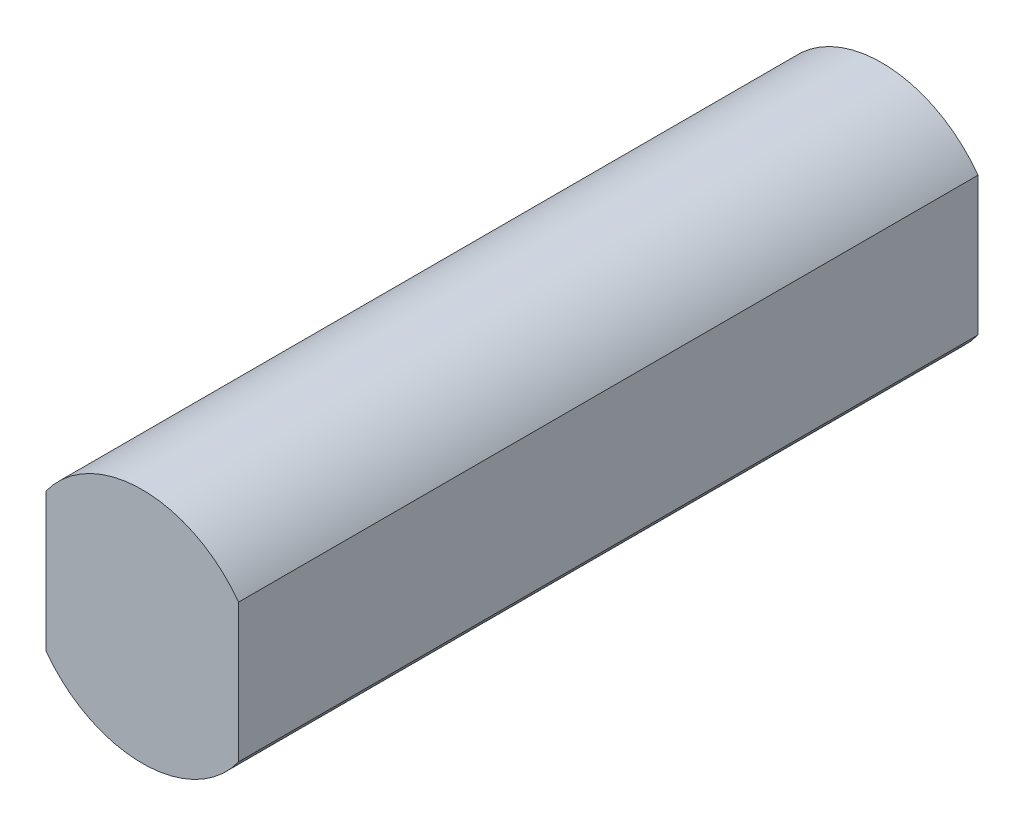
from build123d import *

# Parameters (mm, degrees)
BOSS_EXTRUDE1_DEPTH = 78.070935073


with BuildPart() as part:
    # Sketch1 → Boss-Extrude1 (new body)
    with BuildSketch(Plane.XY):
        with BuildLine():
            Line((-10.16, 7.3025), (-10.16, -7.3025))
            ThreePointArc((-10.16, -7.3025), (0, -12.513918728), (10.16, -7.3025))
            Line((10.16, -7.3025), (10.16, 7.3025))
            ThreePointArc((10.16, 7.3025), (0, 12.513918728), (-10.16, 7.3025))
        make_face()
    extrude(amount=BOSS_EXTRUDE1_DEPTH)


solid = part.part
